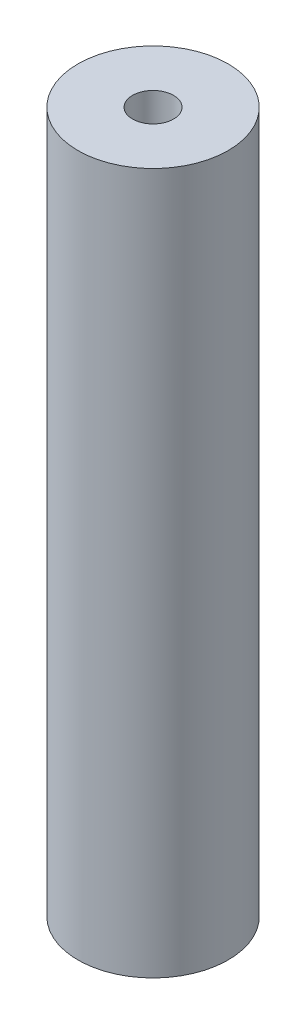
from build123d import *

# Parameters (mm, degrees)
SKETCH1_R           = 7.5
EXTRUSION1_DEPTH    = 160
SKETCH2_R           = 2.25
EXTRUSION2_DEPTH    = 80
SKETCH4_R           = 9.988310786
EXTRUSION4_DEPTH    = 45
SKETCH5_R           = 7.5
SKETCH5_R_2         = 4
EXTRUSION5_DEPTH    = 15
SKETCH6_R           = 13.00139778
CUT_EXTRUDE1_DEPTH  = 45
SKETCH7_R           = 4.639288825
SKETCH7_R_2         = 2.05
BOSS_EXTRUDE1_DEPTH = 70


with BuildPart() as part:
    # Sketch1 → Extrusion1 (new body)
    with BuildSketch(Plane(origin=(0, 0, 0), x_dir=(-1, 0, 0), z_dir=(0, 1, 0))):
        with Locations(Location((0, 0, 0), (0, 0, 90))):
            Circle(SKETCH1_R)
    extrude(amount=EXTRUSION1_DEPTH)

    # Sketch2 → Extrusion2 (cut)
    with BuildSketch(Plane(origin=(0, 160, 0), x_dir=(-1, 0, 0), z_dir=(0, 1, 0))):
        with Locations(Location((0, 0, 0), (0, 0, 90))):
            Circle(SKETCH2_R)
    extrude(amount=-EXTRUSION2_DEPTH, mode=Mode.SUBTRACT)

    # Sketch4 → Extrusion4 (cut)
    with BuildSketch(Plane.XZ):
        Circle(SKETCH4_R)
    extrude(amount=-EXTRUSION4_DEPTH, mode=Mode.SUBTRACT)

    # Sketch5 → Extrusion5 (cut)
    with BuildSketch(Plane.XZ.offset(-45)):
        with Locations(Location((0, 0, 0), (0, 0, 270))):
            Circle(SKETCH5_R)
        with Locations(Location((0, 0, 0), (0, 0, 270))):
            Circle(SKETCH5_R_2, mode=Mode.SUBTRACT)
    extrude(amount=-EXTRUSION5_DEPTH, mode=Mode.SUBTRACT)

    # Sketch6 → Cut-Extrude1 (cut)
    with BuildSketch(Plane.XZ.offset(-45)):
        Circle(SKETCH6_R)
    extrude(amount=-CUT_EXTRUDE1_DEPTH, mode=Mode.SUBTRACT)

    # Sketch7 → Boss-Extrude1 (add)
    with BuildSketch(Plane.XZ.offset(-90)):
        Circle(SKETCH7_R)
        with Locations(Location((0, 0, 0), (0, 0, 270))):
            Circle(SKETCH7_R_2, mode=Mode.SUBTRACT)
    extrude(amount=-BOSS_EXTRUDE1_DEPTH)


solid = part.part
